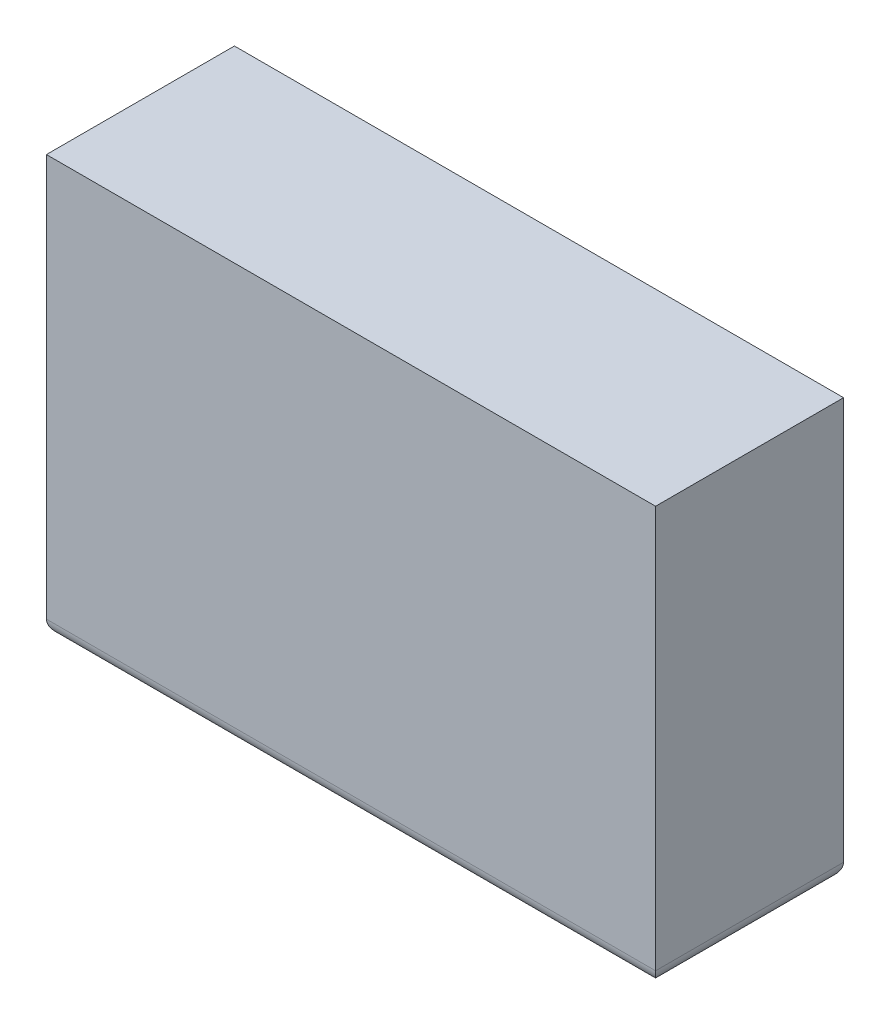
from build123d import *

# Parameters (mm, degrees)
SKETCH1_R             = 5
BOSS_EXTRUDE1_DEPTH   = 10
BOSS_EXTRUDE1_2_DEPTH = 10
SKETCH1_3_W           = 162
SKETCH1_3_H           = 50
BOSS_EXTRUDE2_DEPTH   = 4
SKETCH1_4_W           = 162
SKETCH1_4_H           = 50
SKETCH1_4_W_2         = 154
SKETCH1_4_H_2         = 42
BOSS_EXTRUDE3_DEPTH   = 96
FILLET1_R             = 4
SKETCH2_W             = 162
SKETCH2_H             = 50
SKETCH2_W_2           = 154
SKETCH2_H_2           = 42
BOSS_EXTRUDE4_DEPTH   = 5
SKETCH2_2_W           = 162
SKETCH2_2_H           = 50
SKETCH2_2_W_2         = 154
SKETCH2_2_H_2         = 42
BOSS_EXTRUDE5_DEPTH   = 5
SKETCH3_R             = 5
CUT_EXTRUDE1_DEPTH    = 10
SKETCH4_W             = 162
SKETCH4_H             = 50
BOSS_EXTRUDE6_DEPTH   = 10


with BuildPart() as part:
    # Sketch1 → Boss-Extrude1 (new body)
    with BuildSketch(Plane(origin=(0, 0, 0), x_dir=(1, 0, 0), z_dir=(0, 1, 0))):
        with Locations((-57, 8.550438596)):
            Circle(SKETCH1_R)
    extrude(amount=-BOSS_EXTRUDE1_DEPTH)



with BuildPart() as body_2:
    # Sketch1 → Boss-Extrude1 2 (new body)
    with BuildSketch(Plane(origin=(0, 0, 0), x_dir=(1, 0, 0), z_dir=(0, 1, 0))):
        with Locations((57, 8.550438596)):
            Circle(SKETCH1_R)
    extrude(amount=-BOSS_EXTRUDE1_2_DEPTH)


with BuildPart() as part_1:
    add(part.part)

    add(body_2.part)  # Boss-Extrude2 merges body 2
    # Sketch1<3> → Boss-Extrude2 (add)
    with BuildSketch(Plane(origin=(0, 0, 0), x_dir=(1, 0, 0), z_dir=(0, 1, 0))):
        with Locations((0, 8.550438596)):
            Rectangle(SKETCH1_3_W, SKETCH1_3_H)
    extrude(amount=BOSS_EXTRUDE2_DEPTH)

    # Sketch1<4> → Boss-Extrude3 (add)
    with BuildSketch(Plane(origin=(0, 0, 0), x_dir=(1, 0, 0), z_dir=(0, 1, 0))):
        with Locations((0, 8.550438596)):
            Rectangle(SKETCH1_4_W, SKETCH1_4_H)
        with Locations((0, 8.550438596)):
            Rectangle(SKETCH1_4_W_2, SKETCH1_4_H_2, mode=Mode.SUBTRACT)
    extrude(amount=BOSS_EXTRUDE3_DEPTH)

    # Fillet1
    fillet1_edges = [part_1.edges().sort_by_distance(p)[0] for p in [
        (0, 0, -33.550438596),
        (-81, 0, -8.550438596),
        (81, 0, -8.550438596),
        (0, 0, 16.449561404),
    ]]
    fillet(fillet1_edges, radius=FILLET1_R)



with BuildPart() as body_2_2:
    # Sketch2 → Boss-Extrude4 (new body)
    with BuildSketch(Plane(origin=(0, 96, 0), x_dir=(1, 0, 0), z_dir=(0, 1, 0))):
        with Locations((0, 8.550438596)):
            Rectangle(SKETCH2_W, SKETCH2_H)
        with Locations((0, 8.550438596)):
            Rectangle(SKETCH2_W_2, SKETCH2_H_2, mode=Mode.SUBTRACT)
    extrude(amount=BOSS_EXTRUDE4_DEPTH)


with BuildPart() as part_2:
    add(part_1.part)

    add(body_2_2.part)  # Boss-Extrude5 merges body 2 2
    # Sketch2<2> → Boss-Extrude5 (add)
    with BuildSketch(Plane(origin=(0, 96, 0), x_dir=(1, 0, 0), z_dir=(0, 1, 0))):
        with Locations((0, 8.550438596)):
            Rectangle(SKETCH2_2_W, SKETCH2_2_H)
        with Locations((0, 8.550438596)):
            Rectangle(SKETCH2_2_W_2, SKETCH2_2_H_2, mode=Mode.SUBTRACT)
    extrude(amount=BOSS_EXTRUDE5_DEPTH)

    # Sketch3 → Cut-Extrude1 (cut)
    with BuildSketch(Plane(origin=(0, 0, -33.550438596), x_dir=(-1, 0, 0), z_dir=(0, 0, -1))):
        with Locations((0, 53.488312156)):
            Circle(SKETCH3_R)
    extrude(amount=-CUT_EXTRUDE1_DEPTH, mode=Mode.SUBTRACT)

    # Sketch4 → Boss-Extrude6 (add)
    with BuildSketch(Plane(origin=(0, 101, 0), x_dir=(1, 0, 0), z_dir=(0, 1, 0))):
        with Locations((0, 8.550438596)):
            Rectangle(SKETCH4_W, SKETCH4_H)
    extrude(amount=BOSS_EXTRUDE6_DEPTH)


solid = part_2.part
